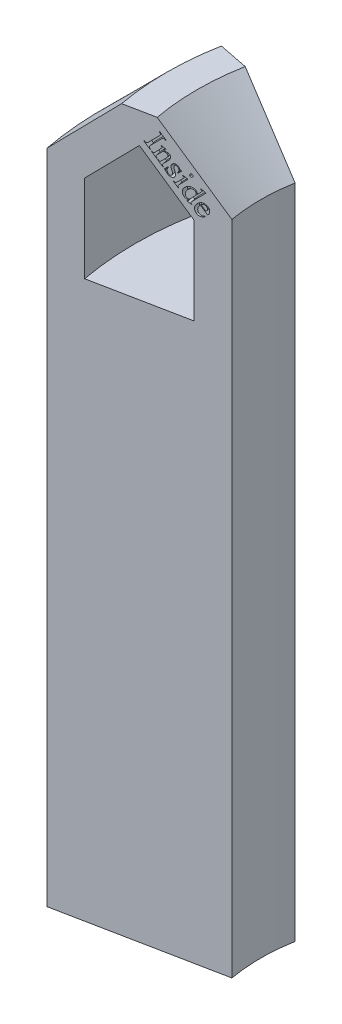
from build123d import *

# Parameters (mm, degrees)
BOSS_EXTRUDE1_DEPTH     = 66.04
REVOLVE1_ANGLE          = 22.5
CUT_EXTRUDE_THIN1_DEPTH = 0.381
CIRPATTERN1_COUNT       = 2
CIRPATTERN1_ANGLE       = 22.5
CUT_EXTRUDE1_DEPTH      = 0.762


with BuildPart() as part:
    # Sketch1 → Boss-Extrude1 (new body)
    with BuildSketch(Plane(origin=(0, 0, 0), x_dir=(1, 0, 0), z_dir=(0, 1, 0))):
        with BuildLine():
            Line((-39.049475547, 7.767423626), (-20.739195147, 4.125282404))
            ThreePointArc((-20.739195147, 4.125282404), (-21.1455, 0), (-20.739195147, -4.125282404))
            Line((-20.739195147, -4.125282404), (-39.049475547, -7.767423626))
            ThreePointArc((-39.049475547, -7.767423626), (-39.8145, 0), (-39.049475547, 7.767423626))
        make_face()
    extrude(amount=BOSS_EXTRUDE1_DEPTH)

    # Sketch2 → Revolve1 (revolve, symmetric)
    with BuildSketch(Plane.XY) as revolve1_sk:
        Polygon((-39.8145, 66.04), (-39.8145, 77.968653673), (-32.276051224, 85.507102448), (-28.683948776, 85.507102448), (-21.1455, 77.968653673), (-21.1455, 66.04), (-24.9555, 66.04), (-24.9555, 76.3905), (-30.48, 81.915), (-36.0045, 76.3905), (-36.0045, 66.04), align=None)
    revolve(axis=Axis((0, 89.782457571, 0), (0, -1, 0)), revolution_arc=REVOLVE1_ANGLE / 2)
    revolve(revolve1_sk.sketch, axis=Axis((0, 89.782457571, 0), (0, 1, 0)), revolution_arc=REVOLVE1_ANGLE / 2)

    # Sketch3 → Cut-Extrude-Thin1 (cut, symmetric)
    with BuildSketch(Plane(origin=(0, 82.55, 0), x_dir=(0.9760625312022038, 0.09801714032955729, -0.19415090879200855), z_dir=(-0.19509032201612525, 0, -0.9807852804032311))):
        Polygon((-8.091314934, 82.152499187), (-47.903679925, 78.231323488), (-35.455503103, -48.157136799), (4.356861888, -44.235961101), align=None)
    cut_extrude_thin1 = extrude(amount=CUT_EXTRUDE_THIN1_DEPTH, both=True, mode=Mode.SUBTRACT)

    # CirPattern1: Cut-Extrude-Thin1 ×2 about axis
    cirpattern1_axis = Axis((0, 66.04, 0), (0, -1, 0))
    for i in range(1, CIRPATTERN1_COUNT):
        add(cut_extrude_thin1.rotate(cirpattern1_axis, i * CIRPATTERN1_ANGLE / (CIRPATTERN1_COUNT - 1)), mode=Mode.SUBTRACT)

    # Sketch4 → Cut-Extrude1 (cut)
    # profile 1 of 7: a face of its own
    with BuildSketch(Plane(origin=(-0.074329413, 0, -0.373679192), x_dir=(0.9807852804032311, 0, -0.19509032201612525), z_dir=(0.19509032201612525, 0, 0.9807852804032311))):
        with BuildLine():
            add(Edge.make_bspline(
                [(-24.327466525, 78.206097037), (-24.346821118, 78.18639306), (-24.384465422, 78.148069213), (-24.43388239, 78.086997215), (-24.477670096, 78.026469577), (-24.514101296, 77.964952364), (-24.542881096, 77.902462627), (-24.565652124, 77.839890714), (-24.580731533, 77.776406039), (-24.585529454, 77.733716024), (-24.587915744, 77.712483756)],
                knots=[0, 0, 0, 0, 1.161636047, 2.259359291, 3.302084689, 4.303398904, 5.262322071, 6.193368654, 7.101455399, 8, 8, 8, 8], degree=3))
            add(Edge.make_bspline(
                [(-24.587915744, 77.712483756), (-24.588959994, 77.691818317), (-24.59099958, 77.651455455), (-24.58756003, 77.59207217), (-24.578078231, 77.535728183), (-24.563229736, 77.482289643), (-24.542652563, 77.431741467), (-24.516891469, 77.384052478), (-24.485475585, 77.339169423), (-24.460280061, 77.312661235), (-24.447521213, 77.299237662)],
                knots=[0, 0, 0, 0, 1.100585267, 2.149616639, 3.157995656, 4.135924672, 5.095184397, 6.05597681, 7.015559409, 8, 8, 8, 8], degree=3))
            add(Edge.make_bspline(
                [(-24.447521213, 77.299237662), (-24.429630724, 77.282784842), (-24.394695438, 77.250656934), (-24.335239961, 77.212967086), (-24.271894216, 77.18615224), (-24.215901441, 77.173437053), (-24.169301166, 77.168439494), (-24.132258776, 77.169435396), (-24.093423688, 77.172717289), (-24.0528858, 77.179988076), (-24.010317998, 77.189698254), (-23.96633458, 77.204090739), (-23.920114274, 77.220615644), (-23.889336027, 77.234215366), (-23.873540744, 77.241194693)],
                knots=[0, 0, 0, 0, 1.406948714, 2.747390434, 4.057875916, 5.37647204, 6.060453853, 6.769961423, 7.52075776, 8.318272485, 9.155426929, 10.049905726, 10.9992188, 12, 12, 12, 12], degree=3))
            Line((-23.873540744, 77.241194693), (-23.8611384, 77.18116735))
            add(Edge.make_bspline(
                [(-23.8611384, 77.18116735), (-23.876837655, 77.170142838), (-23.908123633, 77.148172838), (-23.958175336, 77.12015706), (-24.009608482, 77.094964105), (-24.063603502, 77.074855084), (-24.119418738, 77.057893074), (-24.177195747, 77.044333164), (-24.237307247, 77.035716312), (-24.298388809, 77.030080691), (-24.359703512, 77.029104795), (-24.419319005, 77.035398095), (-24.476998355, 77.04650585), (-24.532183531, 77.064596116), (-24.585129951, 77.08848202), (-24.635522824, 77.118674959), (-24.684037429, 77.15442451), (-24.71370187, 77.182334888), (-24.728806369, 77.196546256)],
                knots=[0, 0, 0, 0, 0.974023999, 1.941066178, 2.910550433, 3.881089801, 4.864453451, 5.87325648, 6.892708454, 7.946947241, 8.988760006, 10.00196145, 10.98726121, 11.967641532, 12.945246048, 13.932227849, 14.94713464, 16, 16, 16, 16], degree=3))
            add(Edge.make_bspline(
                [(-24.728806369, 77.196546256), (-24.74419155, 77.212957489), (-24.774628657, 77.245424473), (-24.813943765, 77.29869392), (-24.846444684, 77.355175468), (-24.872222636, 77.414675345), (-24.892427057, 77.476870912), (-24.905111538, 77.542344985), (-24.911516859, 77.610632967), (-24.911433592, 77.681217198), (-24.904858352, 77.752959017), (-24.889581843, 77.823997595), (-24.867673218, 77.8942238), (-24.83785971, 77.963293132), (-24.799585713, 78.030794123), (-24.75480564, 78.097716993), (-24.702037111, 78.163318765), (-24.662322625, 78.204736242), (-24.641989963, 78.225940787)],
                knots=[0, 0, 0, 0, 0.934100157, 1.847966912, 2.743675563, 3.635978115, 4.537753917, 5.455409832, 6.400963139, 7.383513908, 8.38443971, 9.388379646, 10.396706848, 11.436952101, 12.507415306, 13.616520744, 14.779727873, 16, 16, 16, 16], degree=3))
            add(Edge.make_bspline(
                [(-24.641989963, 78.225940787), (-24.619163307, 78.247965617), (-24.57458209, 78.290980843), (-24.504037521, 78.347763453), (-24.433415236, 78.397132589), (-24.361650845, 78.437313553), (-24.289461901, 78.470112587), (-24.216400678, 78.493949297), (-24.142709447, 78.509569363), (-24.069020092, 78.516801257), (-23.996205162, 78.517013094), (-23.925415428, 78.509406342), (-23.857084872, 78.495300824), (-23.791545906, 78.472956557), (-23.728395077, 78.444302095), (-23.668111274, 78.408242643), (-23.610335667, 78.365250893), (-23.575059695, 78.331823612), (-23.557032931, 78.314741568)],
                knots=[0, 0, 0, 0, 1.243069482, 2.427756017, 3.546360549, 4.617532534, 5.647758371, 6.650337774, 7.624356991, 8.595264042, 9.548321492, 10.474084257, 11.38198954, 12.277940667, 13.183133459, 14.096002218, 15.027017065, 16, 16, 16, 16], degree=3))
            add(Edge.make_bspline(
                [(-23.557032931, 78.314741568), (-23.542495807, 78.299640474), (-23.513956908, 78.269994404), (-23.477293187, 78.221589269), (-23.446368323, 78.171699591), (-23.420631002, 78.120380743), (-23.401351688, 78.066865396), (-23.387304198, 78.011731922), (-23.37938624, 77.95483404), (-23.377477418, 77.89681819), (-23.381334664, 77.838616844), (-23.391478225, 77.780966688), (-23.40717602, 77.724296517), (-23.42986491, 77.668829032), (-23.458719844, 77.614700068), (-23.494044166, 77.561917747), (-23.534413782, 77.509455016), (-23.565793223, 77.477041336), (-23.581837619, 77.460468131)],
                knots=[0, 0, 0, 0, 1.045712349, 2.05291485, 3.024259095, 3.973100843, 4.913283778, 5.858347057, 6.808695986, 7.775151561, 8.751534513, 9.715165222, 10.69266436, 11.681462838, 12.700772381, 13.749445942, 14.849285461, 16, 16, 16, 16], degree=3))
            Line((-23.581837619, 77.460468131), (-24.327466525, 78.206097037))
        make_face()
        with BuildLine():
            Line((-24.259005588, 78.274557975), (-23.759439181, 77.774991568))
            add(Edge.make_bspline(
                [(-23.759439181, 77.774991568), (-23.744505688, 77.792015567), (-23.716807421, 77.82359125), (-23.681906116, 77.869321291), (-23.65519755, 77.908678981), (-23.64357261, 77.934251982), (-23.638392306, 77.945647818)],
                knots=[0, 0, 0, 0, 1.292863799, 2.397971158, 3.286104148, 4, 4, 4, 4], degree=3))
            add(Edge.make_bspline(
                [(-23.638392306, 77.945647818), (-23.632908096, 77.961386521), (-23.622071923, 77.992484396), (-23.615090414, 78.040972922), (-23.614226038, 78.089436479), (-23.621562564, 78.137111847), (-23.63416033, 78.183035405), (-23.652555814, 78.225530539), (-23.676485879, 78.264051074), (-23.696725578, 78.285932854), (-23.706853244, 78.296882193)],
                knots=[0, 0, 0, 0, 1.056040173, 2.086614572, 3.094638458, 4.123660585, 5.13757302, 6.110933488, 7.054737261, 8, 8, 8, 8], degree=3))
            add(Edge.make_bspline(
                [(-23.706853244, 78.296882193), (-23.723627998, 78.311923799), (-23.757096721, 78.341934571), (-23.818279756, 78.372475575), (-23.885689228, 78.391779508), (-23.958725073, 78.39769746), (-24.03521855, 78.391102415), (-24.112159589, 78.368035112), (-24.188219037, 78.328997402), (-24.234738934, 78.293220598), (-24.259005588, 78.274557975)],
                knots=[0, 0, 0, 0, 0.88625929, 1.768250448, 2.671475002, 3.641616052, 4.644859199, 5.686244715, 6.793052009, 8, 8, 8, 8], degree=3))
        make_face(mode=Mode.SUBTRACT)
    # profile 2 of 7: a face of its own
    with BuildSketch(Plane(origin=(-0.074329413, 0, -0.373679192), x_dir=(0.9807852804032311, 0, -0.19509032201612525), z_dir=(0.19509032201612525, 0, 0.9807852804032311))):
        with BuildLine():
            add(Edge.make_bspline(
                [(-25.510106127, 78.286275021), (-25.536076218, 78.286241322), (-25.58578181, 78.286176824), (-25.657553489, 78.291876472), (-25.722806053, 78.303722804), (-25.782673156, 78.320543558), (-25.837512698, 78.343823934), (-25.888880312, 78.372817278), (-25.937497176, 78.407580592), (-25.966647151, 78.435080541), (-25.98139519, 78.448993771)],
                knots=[0, 0, 0, 0, 1.212323014, 2.320331972, 3.356236459, 4.304401923, 5.217885919, 6.130586425, 7.054195313, 8, 8, 8, 8], degree=3))
            add(Edge.make_bspline(
                [(-25.98139519, 78.448993771), (-25.995482983, 78.463897691), (-26.023422141, 78.493455406), (-26.058633821, 78.542878289), (-26.087570773, 78.595616819), (-26.111185789, 78.651182965), (-26.127790346, 78.710429421), (-26.139483416, 78.772492471), (-26.14408538, 78.838018216), (-26.143170125, 78.905918125), (-26.13583858, 78.974707466), (-26.12185031, 79.042855572), (-26.101099718, 79.10942968), (-26.072732578, 79.174267572), (-26.038730007, 79.23799814), (-25.99685461, 79.299727093), (-25.949037218, 79.360376819), (-25.91260979, 79.398154784), (-25.89408269, 79.417368771)],
                knots=[0, 0, 0, 0, 0.909458615, 1.803654218, 2.684097984, 3.575608536, 4.476945095, 5.409826327, 6.374142149, 7.387145793, 8.42060399, 9.439758032, 10.470475822, 11.509419077, 12.576728051, 13.671938721, 14.815941005, 16, 16, 16, 16], degree=3))
            add(Edge.make_bspline(
                [(-25.89408269, 79.417368771), (-25.874562828, 79.436092817), (-25.835814189, 79.473261689), (-25.772201702, 79.522283565), (-25.705798923, 79.566074427), (-25.635983927, 79.604059216), (-25.562662846, 79.635743874), (-25.486109964, 79.662221), (-25.406091335, 79.682435716), (-25.324026423, 79.696671384), (-25.241896376, 79.704648539), (-25.161854905, 79.703142792), (-25.085137356, 79.693219326), (-25.011704044, 79.67500355), (-24.941814083, 79.647356658), (-24.875280788, 79.611362568), (-24.812263645, 79.566517535), (-24.774330565, 79.530781347), (-24.75505144, 79.512618771)],
                knots=[0, 0, 0, 0, 1.024040451, 2.032810122, 3.037095918, 4.035031117, 5.039414601, 6.059692443, 7.100477467, 8.16231622, 9.212709849, 10.221479521, 11.188111894, 12.137725375, 13.080016395, 14.02745772, 14.997474224, 16, 16, 16, 16], degree=3))
            add(Edge.make_bspline(
                [(-24.75505144, 79.512618771), (-24.743758568, 79.500734377), (-24.721500208, 79.47731012), (-24.692350225, 79.439556274), (-24.667202125, 79.400675512), (-24.64673747, 79.36027465), (-24.63085289, 79.31851681), (-24.619310954, 79.275480203), (-24.612337726, 79.231221653), (-24.610910181, 79.201260712), (-24.610192065, 79.186189084)],
                knots=[0, 0, 0, 0, 1.072737973, 2.114377069, 3.11743726, 4.100312615, 5.073480616, 6.037269195, 7.012662821, 8, 8, 8, 8], degree=3))
            Line((-24.610192065, 79.186189084), (-24.410762377, 79.385618771))
            add(Edge.make_bspline(
                [(-24.410762377, 79.385618771), (-24.39622235, 79.400348003), (-24.368620893, 79.428308629), (-24.329249224, 79.467824316), (-24.2949953, 79.503687849), (-24.265386553, 79.535264553), (-24.240299429, 79.56247768), (-24.220591094, 79.585902048), (-24.20496044, 79.604724761), (-24.190680921, 79.623822481), (-24.178898659, 79.644649434), (-24.168559587, 79.667110893), (-24.162475696, 79.687716697), (-24.161959299, 79.712381373), (-24.170332374, 79.742164429), (-24.186188654, 79.76018746), (-24.194465502, 79.769595334)],
                knots=[0, 0, 0, 0, 1.79252827, 3.402771678, 4.831018308, 6.087433976, 7.15198616, 8.035892605, 8.738250315, 9.271056011, 10.098881991, 10.804154062, 11.412118543, 11.942222563, 12.925857062, 14, 14, 14, 14], degree=3))
            add(Edge.make_bspline(
                [(-24.194465502, 79.769595334), (-24.20033366, 79.774822708), (-24.213022295, 79.786125784), (-24.235551533, 79.802170721), (-24.26358924, 79.817051149), (-24.283895285, 79.826883058), (-24.29467644, 79.832103146)],
                knots=[0, 0, 0, 0, 0.794501395, 1.717939085, 2.788377944, 4, 4, 4, 4], degree=3))
            Line((-24.29467644, 79.832103146), (-24.268879565, 79.888657834))
            Line((-24.268879565, 79.888657834), (-23.814953784, 79.698653927))
            Line((-23.814953784, 79.698653927), (-23.761871752, 79.645571896))
            Line((-23.761871752, 79.645571896), (-25.009547534, 78.397896115))
            add(Edge.make_bspline(
                [(-25.009547534, 78.397896115), (-25.024640625, 78.382892498), (-25.053169251, 78.354532995), (-25.093040802, 78.313538542), (-25.128120239, 78.277014279), (-25.158488763, 78.244857299), (-25.183678331, 78.216830399), (-25.204894007, 78.193941383), (-25.220156054, 78.174363146), (-25.234496392, 78.155341059), (-25.246546703, 78.13468223), (-25.256948973, 78.112008835), (-25.261996987, 78.090737495), (-25.263644837, 78.06578783), (-25.255746654, 78.036270597), (-25.240802672, 78.018429048), (-25.233285815, 78.009454709)],
                knots=[0, 0, 0, 0, 1.822378418, 3.444619086, 4.896824697, 6.159106884, 7.231674298, 8.124242593, 8.829719922, 9.356525323, 10.162810505, 10.873103435, 11.484474848, 12.02332307, 13.00572703, 14, 14, 14, 14], degree=3))
            add(Edge.make_bspline(
                [(-25.233285815, 78.009454709), (-25.22728264, 78.004018304), (-25.214131183, 77.9921085), (-25.190096479, 77.976164343), (-25.1612618, 77.959745187), (-25.139936186, 77.94976628), (-25.128610034, 77.944466427)],
                knots=[0, 0, 0, 0, 0.784314892, 1.718237828, 2.788143424, 4, 4, 4, 4], degree=3))
            Line((-25.128610034, 77.944466427), (-25.156887377, 77.890392209))
            Line((-25.156887377, 77.890392209), (-25.610317065, 78.077915646))
            Line((-25.610317065, 78.077915646), (-25.664391284, 78.131989865))
            Line((-25.664391284, 78.131989865), (-25.510106127, 78.286275021))
        make_face()
        with BuildLine():
            Line((-25.427754565, 78.368626584), (-24.871633471, 78.924747677))
            add(Edge.make_bspline(
                [(-24.871633471, 78.924747677), (-24.860071563, 78.939404855), (-24.837329324, 78.968235481), (-24.809008059, 79.014963067), (-24.785514729, 79.063044779), (-24.76767553, 79.112600004), (-24.755574841, 79.162305648), (-24.750444385, 79.211538892), (-24.752299737, 79.259707863), (-24.76155935, 79.305914723), (-24.775232383, 79.349596993), (-24.7934536, 79.389075106), (-24.81546482, 79.424328601), (-24.833459741, 79.444231439), (-24.84236394, 79.454079709)],
                knots=[0, 0, 0, 0, 1.154423248, 2.270747131, 3.373857381, 4.461573529, 5.524008054, 6.532166117, 7.51550029, 8.494992464, 9.440090433, 10.3421512, 11.179667723, 12, 12, 12, 12], degree=3))
            add(Edge.make_bspline(
                [(-24.84236394, 79.454079709), (-24.851076435, 79.46244155), (-24.868373493, 79.47904245), (-24.898183464, 79.499358671), (-24.930001196, 79.516218776), (-24.963866857, 79.529804934), (-25.000066389, 79.539157204), (-25.03828838, 79.545003035), (-25.078814516, 79.547584054), (-25.10645155, 79.54644379), (-25.120672534, 79.545857052)],
                knots=[0, 0, 0, 0, 0.956343444, 1.898644233, 2.849124082, 3.808699638, 4.785332493, 5.807406151, 6.871773192, 8, 8, 8, 8], degree=3))
            add(Edge.make_bspline(
                [(-25.120672534, 79.545857052), (-25.139920339, 79.543798153), (-25.178805241, 79.539638713), (-25.236977413, 79.525400534), (-25.294938873, 79.503710249), (-25.353333063, 79.475845913), (-25.411562247, 79.440647995), (-25.470109508, 79.398878093), (-25.528864224, 79.350004144), (-25.566562616, 79.313607825), (-25.586008471, 79.294833615)],
                knots=[0, 0, 0, 0, 0.859528183, 1.736440549, 2.652447478, 3.605635851, 4.60754701, 5.671944745, 6.799125865, 8, 8, 8, 8], degree=3))
            add(Edge.make_bspline(
                [(-25.586008471, 79.294833615), (-25.604920754, 79.2751986), (-25.641667685, 79.237047384), (-25.691526274, 79.177958291), (-25.734305572, 79.118920785), (-25.770393658, 79.060071793), (-25.799729915, 79.001463467), (-25.822979657, 78.943173643), (-25.83906235, 78.884940958), (-25.847681232, 78.827288445), (-25.851252648, 78.771662541), (-25.849708484, 78.718711341), (-25.844110238, 78.66893914), (-25.833013633, 78.622402975), (-25.817624981, 78.578942061), (-25.797798153, 78.538461111), (-25.772956448, 78.501182073), (-25.7525281, 78.479644288), (-25.742278002, 78.468837521)],
                knots=[0, 0, 0, 0, 1.403451492, 2.726933471, 3.977062213, 5.154039808, 6.277344553, 7.347773462, 8.380561495, 9.380066995, 10.344052965, 11.24695433, 12.104515681, 12.918221288, 13.70460606, 14.473793649, 15.234212986, 16, 16, 16, 16], degree=3))
            add(Edge.make_bspline(
                [(-25.742278002, 78.468837521), (-25.733047821, 78.460328831), (-25.714363007, 78.443104543), (-25.682580079, 78.421601653), (-25.647806156, 78.403130149), (-25.609472998, 78.389876113), (-25.568445646, 78.378618582), (-25.524247219, 78.371295612), (-25.476922002, 78.367896316), (-25.444460318, 78.368378459), (-25.427754565, 78.368626584)],
                knots=[0, 0, 0, 0, 0.885953479, 1.793450963, 2.702827093, 3.660182263, 4.652206202, 5.706804258, 6.819852917, 8, 8, 8, 8], degree=3))
        make_face(mode=Mode.SUBTRACT)
    # profile 3 of 7: a face of its own
    with BuildSketch(Plane(origin=(-0.074329413, 0, -0.373679192), x_dir=(0.9807852804032311, 0, -0.19509032201612525), z_dir=(0.19509032201612525, 0, 0.9807852804032311))):
        with BuildLine():
            add(Edge.make_bspline(
                [(-25.118055212, 81.001676852), (-25.110354367, 80.993388631), (-25.09521867, 80.977098467), (-25.080059561, 80.947572771), (-25.070046485, 80.916044998), (-25.067593511, 80.882768216), (-25.070191162, 80.8494002), (-25.079802738, 80.817865665), (-25.095521364, 80.788499801), (-25.11039569, 80.772031955), (-25.118055212, 80.763551852)],
                knots=[0, 0, 0, 0, 1.020809164, 2.006359082, 2.978140455, 4.001147273, 5.009226956, 5.995346391, 6.967705346, 8, 8, 8, 8], degree=3))
            add(Edge.make_bspline(
                [(-25.118055212, 80.763551852), (-25.126396388, 80.756102448), (-25.142926204, 80.741339867), (-25.172121988, 80.725267184), (-25.204096059, 80.715835525), (-25.237592444, 80.712349875), (-25.271075401, 80.71535919), (-25.302946999, 80.724151155), (-25.332211915, 80.740073398), (-25.348688035, 80.754916317), (-25.357172399, 80.762559665)],
                knots=[0, 0, 0, 0, 1.008168586, 1.997900662, 2.981069905, 4.002437856, 5.022384127, 6.00134375, 6.97079368, 8, 8, 8, 8], degree=3))
            add(Edge.make_bspline(
                [(-25.357172399, 80.762559665), (-25.364672632, 80.770875225), (-25.37948289, 80.787295464), (-25.394800065, 80.816777337), (-25.404671926, 80.84871227), (-25.407113214, 80.882614352), (-25.404671926, 80.916516434), (-25.394800065, 80.948451368), (-25.37948289, 80.977933241), (-25.364672632, 80.994353479), (-25.357172399, 81.00266904)],
                knots=[0, 0, 0, 0, 1.005963088, 1.986414951, 2.967433385, 4, 5.032566615, 6.013585049, 6.994036912, 8, 8, 8, 8], degree=3))
            add(Edge.make_bspline(
                [(-25.357172399, 81.00266904), (-25.348692359, 81.010328396), (-25.332224636, 81.025202402), (-25.30285789, 81.040923335), (-25.271326738, 81.050526073), (-25.237945695, 81.053157745), (-25.204558965, 81.050565248), (-25.172637503, 81.04088788), (-25.143060373, 81.024799478), (-25.126523637, 81.009507724), (-25.118055212, 81.001676852)],
                knots=[0, 0, 0, 0, 1.026825298, 1.99403245, 2.974927176, 3.977665799, 4.99525247, 5.976147196, 6.963589571, 8, 8, 8, 8], degree=3))
        make_face()
    # profile 4 of 7: a face of its own
    with BuildSketch(Plane(origin=(-0.074329413, 0, -0.373679192), x_dir=(0.9807852804032311, 0, -0.19509032201612525), z_dir=(0.19509032201612525, 0, 0.9807852804032311))):
        with BuildLine():
            Line((-25.583887243, 80.339391696), (-26.451059118, 79.472219821))
            add(Edge.make_bspline(
                [(-26.451059118, 79.472219821), (-26.466451003, 79.456509319), (-26.494398753, 79.427983042), (-26.529887931, 79.387113653), (-26.55590645, 79.35352752), (-26.571717455, 79.324576771), (-26.579562744, 79.299161788), (-26.58303862, 79.275403903), (-26.583312813, 79.251921083), (-26.578662762, 79.227816201), (-26.567105396, 79.202170039), (-26.54838528, 79.173606852), (-26.521471086, 79.141311724), (-26.500324534, 79.119190197), (-26.488762243, 79.107094821)],
                knots=[0, 0, 0, 0, 1.796342424, 3.261701174, 4.420867892, 5.260867186, 5.940262287, 6.582225239, 7.217184489, 7.850416738, 8.570628208, 9.50005727, 10.63310754, 12, 12, 12, 12], degree=3))
            Line((-26.488762243, 79.107094821), (-26.531426306, 79.064430759))
            Line((-26.531426306, 79.064430759), (-27.055797399, 79.588801852))
            Line((-27.055797399, 79.588801852), (-27.013133337, 79.631465915))
            add(Edge.make_bspline(
                [(-27.013133337, 79.631465915), (-27.000924803, 79.619505554), (-26.978635594, 79.597669437), (-26.945712654, 79.570978225), (-26.918350636, 79.551052175), (-26.893367216, 79.540051998), (-26.87008633, 79.536011392), (-26.846987996, 79.536238694), (-26.822822747, 79.539613241), (-26.796533745, 79.548163943), (-26.766404489, 79.564122203), (-26.731843411, 79.590007299), (-26.690794975, 79.625187429), (-26.662542992, 79.652929984), (-26.647016149, 79.668176852)],
                knots=[0, 0, 0, 0, 1.390742953, 2.539089619, 3.45042623, 4.138259404, 4.740487588, 5.35993424, 6.013150583, 6.720095677, 7.599431319, 8.776629534, 10.228486655, 12, 12, 12, 12], degree=3))
            Line((-26.647016149, 79.668176852), (-26.231289587, 80.083903415))
            add(Edge.make_bspline(
                [(-26.231289587, 80.083903415), (-26.217374979, 80.09793598), (-26.190779939, 80.124756472), (-26.153276845, 80.163320617), (-26.119627215, 80.198152366), (-26.090708829, 80.229900782), (-26.065182237, 80.257500565), (-26.044294748, 80.281790861), (-26.027733855, 80.302647936), (-26.018579869, 80.315707112), (-26.014496618, 80.321532321)],
                knots=[0, 0, 0, 0, 1.472950457, 2.815255353, 4.009569287, 5.08246491, 6.016044298, 6.811500611, 7.46985497, 8, 8, 8, 8], degree=3))
            add(Edge.make_bspline(
                [(-26.014496618, 80.321532321), (-26.01024719, 80.328907361), (-26.002301484, 80.342697429), (-25.992832363, 80.36306071), (-25.988196586, 80.382145437), (-25.987388705, 80.405531518), (-25.996238823, 80.435307661), (-26.012614303, 80.453570224), (-26.021441931, 80.463415134)],
                knots=[0, 0, 0, 0, 0.976680293, 1.826225856, 2.567134071, 3.212485338, 4.497317836, 6, 6, 6, 6], degree=3))
            add(Edge.make_bspline(
                [(-26.021441931, 80.463415134), (-26.027418351, 80.469048167), (-26.039981884, 80.480889838), (-26.063059974, 80.496078697), (-26.089543344, 80.511366158), (-26.109011429, 80.520604886), (-26.119172399, 80.525426852)],
                knots=[0, 0, 0, 0, 0.84580649, 1.778040569, 2.840293589, 4, 4, 4, 4], degree=3))
            Line((-26.119172399, 80.525426852), (-26.092879431, 80.584462009))
            Line((-26.092879431, 80.584462009), (-25.635977087, 80.39148154))
            Line((-25.635977087, 80.39148154), (-25.583887243, 80.339391696))
        make_face()
    # profile 5 of 7: a face of its own
    with BuildSketch(Plane(origin=(-0.074329413, 0, -0.373679192), x_dir=(0.9807852804032311, 0, -0.19509032201612525), z_dir=(0.19509032201612525, 0, 0.9807852804032311))):
        with BuildLine():
            Line((-26.20192768, 80.957322229), (-26.569533149, 80.58971676))
            Line((-26.569533149, 80.58971676), (-26.608228462, 80.628412072))
            add(Edge.make_bspline(
                [(-26.608228462, 80.628412072), (-26.598172337, 80.646031271), (-26.578730981, 80.680094208), (-26.552770621, 80.730610505), (-26.531549166, 80.778765464), (-26.513933969, 80.823830656), (-26.500654776, 80.866375838), (-26.492323107, 80.906446246), (-26.487598468, 80.943793776), (-26.486830284, 80.989688414), (-26.495387376, 81.044728111), (-26.51914047, 81.107392506), (-26.554527026, 81.167575083), (-26.586989359, 81.202305612), (-26.603763618, 81.220251916)],
                knots=[0, 0, 0, 0, 1.125042986, 2.175028995, 3.148103104, 4.042260968, 4.857446244, 5.61647911, 6.309236519, 6.942099934, 8.157417897, 9.37034592, 10.64117905, 12, 12, 12, 12], degree=3))
            add(Edge.make_bspline(
                [(-26.603763618, 81.220251916), (-26.617216462, 81.233048016), (-26.643076757, 81.257645855), (-26.687624804, 81.284333527), (-26.732944068, 81.303378343), (-26.779431271, 81.310773092), (-26.823529761, 81.310342711), (-26.863839149, 81.303347206), (-26.899390134, 81.287866411), (-26.918306754, 81.271533456), (-26.927712837, 81.263412072)],
                knots=[0, 0, 0, 0, 1.22958479, 2.363620922, 3.428302631, 4.475619269, 5.464212439, 6.347426835, 7.178276054, 8, 8, 8, 8], degree=3))
            add(Edge.make_bspline(
                [(-26.927712837, 81.263412072), (-26.937855157, 81.252303953), (-26.957577858, 81.230703162), (-26.980300718, 81.193645195), (-26.996148387, 81.154175651), (-27.000796813, 81.126450553), (-27.003119087, 81.112599572)],
                knots=[0, 0, 0, 0, 1.049152949, 2.040177271, 3.020906365, 4, 4, 4, 4], degree=3))
            add(Edge.make_bspline(
                [(-27.003119087, 81.112599572), (-27.004103036, 81.096878062), (-27.006296555, 81.061830089), (-26.997843448, 81.003805991), (-26.981694411, 80.935743442), (-26.96597389, 80.887595477), (-26.957478462, 80.861576135)],
                knots=[0, 0, 0, 0, 0.733955819, 1.636208154, 2.722597973, 4, 4, 4, 4], degree=3))
            Line((-26.957478462, 80.861576135), (-26.86867768, 80.606087854))
            add(Edge.make_bspline(
                [(-26.86867768, 80.606087854), (-26.859487237, 80.577477008), (-26.841840718, 80.522541483), (-26.825848826, 80.440837716), (-26.819550891, 80.364252612), (-26.82261848, 80.29259947), (-26.835857019, 80.225833431), (-26.859610105, 80.164352973), (-26.892887693, 80.107820169), (-26.922308444, 80.075622487), (-26.937138618, 80.059392541)],
                knots=[0, 0, 0, 0, 1.236499671, 2.374196078, 3.41913714, 4.393957125, 5.3179953, 6.208175287, 7.09679154, 8, 8, 8, 8], degree=3))
            add(Edge.make_bspline(
                [(-26.937138618, 80.059392541), (-26.949461168, 80.047696262), (-26.973548688, 80.024832946), (-27.013299223, 79.995891834), (-27.054445747, 79.971918695), (-27.097541506, 79.953243259), (-27.142455916, 79.940527409), (-27.188835346, 79.932349517), (-27.236954604, 79.930106505), (-27.285941127, 79.932645129), (-27.334890046, 79.93960509), (-27.3823262, 79.950485086), (-27.428012819, 79.964953401), (-27.471520866, 79.983221006), (-27.513032436, 80.00539343), (-27.552695384, 80.030510874), (-27.590401187, 80.059584418), (-27.613499656, 80.081506679), (-27.625220649, 80.092630822)],
                knots=[0, 0, 0, 0, 1.062902335, 2.077709572, 3.070513532, 4.039930978, 5.009956539, 5.987085382, 6.982477863, 8.019235067, 9.054543418, 10.074356874, 11.063319558, 12.051794254, 13.02452407, 14.006905743, 14.988632349, 16, 16, 16, 16], degree=3))
            add(Edge.make_bspline(
                [(-27.625220649, 80.092630822), (-27.641870711, 80.110245609), (-27.676322823, 80.146693916), (-27.724419419, 80.208378784), (-27.771508067, 80.278005595), (-27.800952278, 80.32810151), (-27.816216743, 80.354072229)],
                knots=[0, 0, 0, 0, 0.8954294, 1.852811898, 2.886855022, 4, 4, 4, 4], degree=3))
            add(Edge.make_bspline(
                [(-27.816216743, 80.354072229), (-27.824416277, 80.369183423), (-27.839031923, 80.396119085), (-27.859031078, 80.419301601), (-27.867810493, 80.429478479)],
                knots=[0, 0, 0, 0, 1.122021362, 2, 2, 2, 2], degree=3))
            add(Edge.make_bspline(
                [(-27.867810493, 80.429478479), (-27.872570381, 80.433428991), (-27.88194345, 80.441208253), (-27.900050208, 80.447615036), (-27.920422025, 80.447052637), (-27.934022787, 80.443348331), (-27.941232368, 80.441384729)],
                knots=[0, 0, 0, 0, 0.939568538, 1.85017787, 2.860408221, 4, 4, 4, 4], degree=3))
            Line((-27.941232368, 80.441384729), (-27.97992768, 80.480080041))
            Line((-27.97992768, 80.480080041), (-27.59495893, 80.865048791))
            Line((-27.59495893, 80.865048791), (-27.556263618, 80.826353479))
            add(Edge.make_bspline(
                [(-27.556263618, 80.826353479), (-27.566743152, 80.810118804), (-27.587217934, 80.778399699), (-27.613365422, 80.729718611), (-27.635477152, 80.681926633), (-27.653024686, 80.634673959), (-27.665730964, 80.587966322), (-27.675216329, 80.542124073), (-27.678870838, 80.496690787), (-27.679017952, 80.452214193), (-27.675053931, 80.409036494), (-27.66734145, 80.367660742), (-27.657518924, 80.327833284), (-27.642366904, 80.29059439), (-27.626023209, 80.254368502), (-27.604745888, 80.220854548), (-27.581089049, 80.188627851), (-27.5626076, 80.169333823), (-27.553287055, 80.159603479)],
                knots=[0, 0, 0, 0, 1.277092358, 2.495167032, 3.649714828, 4.756587, 5.822867475, 6.847765273, 7.846496678, 8.830458041, 9.785633526, 10.707764195, 11.612028382, 12.491158961, 13.36168179, 14.23549376, 15.110126083, 16, 16, 16, 16], degree=3))
            add(Edge.make_bspline(
                [(-27.553287055, 80.159603479), (-27.539803383, 80.147177506), (-27.51369512, 80.123117254), (-27.468874208, 80.096512017), (-27.421871645, 80.079460545), (-27.373567148, 80.073503466), (-27.326220009, 80.075221678), (-27.282164937, 80.087985447), (-27.241022532, 80.107385981), (-27.21879771, 80.12786841), (-27.207509712, 80.138271447)],
                knots=[0, 0, 0, 0, 1.136306935, 2.200216734, 3.213754261, 4.218930848, 5.206265623, 6.133203209, 7.051852917, 8, 8, 8, 8], degree=3))
            add(Edge.make_bspline(
                [(-27.207509712, 80.138271447), (-27.194919165, 80.151991916), (-27.170376794, 80.178736811), (-27.145566453, 80.226831505), (-27.129953402, 80.278104785), (-27.126800793, 80.324120889), (-27.128818831, 80.364274715), (-27.133578374, 80.399185155), (-27.140475415, 80.438621122), (-27.150674406, 80.482216904), (-27.163155586, 80.530493765), (-27.177988232, 80.583271648), (-27.195282413, 80.640579677), (-27.215670653, 80.700384584), (-27.234983121, 80.760656096), (-27.252178352, 80.81825967), (-27.265449793, 80.871790723), (-27.276012919, 80.921069742), (-27.283732511, 80.966059126), (-27.287650249, 81.007005169), (-27.289092787, 81.043679765), (-27.287250717, 81.066634141), (-27.286388618, 81.077376916)],
                knots=[0, 0, 0, 0, 1.134079978, 2.210627688, 3.275958318, 4.391908569, 5.009438168, 5.733079142, 6.544311223, 7.456788893, 8.469627882, 9.593247357, 10.808697884, 12.12924739, 13.456284226, 14.678529015, 15.804148461, 16.827431436, 17.759968392, 18.593024551, 19.341527717, 20, 20, 20, 20], degree=3))
            add(Edge.make_bspline(
                [(-27.286388618, 81.077376916), (-27.282857108, 81.097273542), (-27.27573941, 81.137374853), (-27.250512215, 81.19470169), (-27.215699093, 81.250071539), (-27.185121394, 81.282736663), (-27.169310493, 81.299626916)],
                knots=[0, 0, 0, 0, 0.945180913, 1.904996084, 2.916730108, 4, 4, 4, 4], degree=3))
            add(Edge.make_bspline(
                [(-27.169310493, 81.299626916), (-27.158090513, 81.310262242), (-27.136158802, 81.331051127), (-27.100431698, 81.35816311), (-27.063155496, 81.380990016), (-27.024506044, 81.39991154), (-26.984315909, 81.414638536), (-26.94262549, 81.42424179), (-26.899473943, 81.430523481), (-26.855264453, 81.43161347), (-26.81067555, 81.429591791), (-26.767025059, 81.421832871), (-26.72431486, 81.410348182), (-26.682542318, 81.394657124), (-26.642428496, 81.373473968), (-26.603173281, 81.348371408), (-26.565165423, 81.318768514), (-26.541403407, 81.296195039), (-26.529349555, 81.284744104)],
                knots=[0, 0, 0, 0, 1.034518992, 2.022175717, 2.996334791, 3.956997984, 4.899170909, 5.855229033, 6.816657593, 7.813703136, 8.811731838, 9.800133028, 10.775109745, 11.770370837, 12.780608295, 13.806440196, 14.887264271, 16, 16, 16, 16], degree=3))
            add(Edge.make_bspline(
                [(-26.529349555, 81.284744104), (-26.518563587, 81.273176864), (-26.495861531, 81.248830406), (-26.464128492, 81.206558371), (-26.432601521, 81.157486717), (-26.412731617, 81.121813246), (-26.402349555, 81.103173791)],
                knots=[0, 0, 0, 0, 0.853323411, 1.796055367, 2.848434861, 4, 4, 4, 4], degree=3))
            add(Edge.make_bspline(
                [(-26.402349555, 81.103173791), (-26.395802395, 81.091390604), (-26.383923001, 81.070010782), (-26.367094951, 81.041892676), (-26.353735631, 81.020437205), (-26.344251683, 81.009823428), (-26.340337837, 81.005443322)],
                knots=[0, 0, 0, 0, 1.394172145, 2.529634179, 3.393207811, 4, 4, 4, 4], degree=3))
            add(Edge.make_bspline(
                [(-26.340337837, 81.005443322), (-26.334395819, 80.999995311), (-26.323524649, 80.990027946), (-26.300959885, 80.982019839), (-26.27287808, 80.986290436), (-26.252715501, 80.992370826), (-26.240622993, 80.996017541)],
                knots=[0, 0, 0, 0, 0.89496106, 1.637368848, 2.583011815, 4, 4, 4, 4], degree=3))
            Line((-26.240622993, 80.996017541), (-26.20192768, 80.957322229))
        make_face()
    # profile 6 of 7: a face of its own
    with BuildSketch(Plane(origin=(-0.074329413, 0, -0.373679192), x_dir=(0.9807852804032311, 0, -0.19509032201612525), z_dir=(0.19509032201612525, 0, 0.9807852804032311))):
        with BuildLine():
            add(Edge.make_bspline(
                [(-28.026016501, 82.323871306), (-27.992470462, 82.326455304), (-27.927920663, 82.331427471), (-27.834544266, 82.331641459), (-27.748759919, 82.324801962), (-27.670740575, 82.311856959), (-27.600320467, 82.291900733), (-27.53737133, 82.265871886), (-27.481716134, 82.232802344), (-27.450796151, 82.204680216), (-27.435664939, 82.190918181)],
                knots=[0, 0, 0, 0, 1.293770419, 2.489492691, 3.587069233, 4.600283195, 5.526345912, 6.395744681, 7.214930778, 8, 8, 8, 8], degree=3))
            add(Edge.make_bspline(
                [(-27.435664939, 82.190918181), (-27.421946174, 82.176264018), (-27.395131588, 82.147621108), (-27.363992247, 82.098923489), (-27.340371412, 82.04818808), (-27.326344089, 81.994441166), (-27.321886777, 81.937375055), (-27.327610619, 81.87682595), (-27.344637578, 81.812444369), (-27.362665027, 81.769854121), (-27.372164939, 81.747410369)],
                knots=[0, 0, 0, 0, 0.997534579, 1.949773078, 2.863470944, 3.774047843, 4.699099176, 5.699381836, 6.787644873, 8, 8, 8, 8], degree=3))
            add(Edge.make_bspline(
                [(-27.372164939, 81.747410369), (-27.381384275, 81.730148249), (-27.401728193, 81.692056663), (-27.444191888, 81.634827238), (-27.498268315, 81.570779745), (-27.540512085, 81.527841705), (-27.563161033, 81.504820525)],
                knots=[0, 0, 0, 0, 0.756605725, 1.6695697, 2.750542538, 4, 4, 4, 4], degree=3))
            Line((-27.563161033, 81.504820525), (-28.023536033, 81.044445525))
            add(Edge.make_bspline(
                [(-28.023536033, 81.044445525), (-28.039164522, 81.028624173), (-28.067748405, 80.999687555), (-28.103251735, 80.95730221), (-28.130554844, 80.922152694), (-28.141737106, 80.898771563), (-28.146567283, 80.888672087)],
                knots=[0, 0, 0, 0, 1.33669824, 2.444767595, 3.328217652, 4, 4, 4, 4], degree=3))
            add(Edge.make_bspline(
                [(-28.146567283, 80.888672087), (-28.150525978, 80.874407807), (-28.158524785, 80.84558588), (-28.153276766, 80.806104129), (-28.139423348, 80.773580432), (-28.119860768, 80.745060764), (-28.093312238, 80.712085024), (-28.071548369, 80.689872784), (-28.059750876, 80.677832244)],
                knots=[0, 0, 0, 0, 1.088725464, 2.199842109, 2.864418397, 3.697186905, 4.751719142, 6, 6, 6, 6], degree=3))
            Line((-28.059750876, 80.677832244), (-28.102414939, 80.635168181))
            Line((-28.102414939, 80.635168181), (-28.636211814, 81.168965056))
            Line((-28.636211814, 81.168965056), (-28.593547751, 81.211629119))
            Line((-28.593547751, 81.211629119), (-28.571223533, 81.1893049))
            add(Edge.make_bspline(
                [(-28.571223533, 81.1893049), (-28.559369235, 81.177979094), (-28.53734582, 81.156937534), (-28.503927064, 81.13148093), (-28.473215904, 81.114016811), (-28.444096828, 81.105315787), (-28.416122059, 81.104735749), (-28.388606861, 81.108708927), (-28.36066539, 81.117971056), (-28.34289326, 81.127347978), (-28.333594626, 81.132254119)],
                knots=[0, 0, 0, 0, 1.460707291, 2.713763662, 3.736171621, 4.594749322, 5.391354471, 6.21068783, 7.063806128, 8, 8, 8, 8], degree=3))
            add(Edge.make_bspline(
                [(-28.333594626, 81.132254119), (-28.328435429, 81.136181476), (-28.314597825, 81.146715133), (-28.289902586, 81.168211068), (-28.256947585, 81.200296894), (-28.232036518, 81.224999794), (-28.218004783, 81.238914275)],
                knots=[0, 0, 0, 0, 0.494211936, 1.325537241, 2.493546932, 4, 4, 4, 4], degree=3))
            Line((-28.218004783, 81.238914275), (-27.776481345, 81.680437712))
            add(Edge.make_bspline(
                [(-27.776481345, 81.680437712), (-27.764650662, 81.69242241), (-27.741878961, 81.715490559), (-27.710389971, 81.750248754), (-27.683177166, 81.784076899), (-27.659263816, 81.816300051), (-27.638796429, 81.846943478), (-27.622075732, 81.876335248), (-27.609749341, 81.904706857), (-27.597686095, 81.939778597), (-27.591297241, 81.983612371), (-27.599599246, 82.035829697), (-27.624235327, 82.085515673), (-27.649539799, 82.11360605), (-27.662875876, 82.128410369)],
                knots=[0, 0, 0, 0, 1.152336797, 2.218018182, 3.207692687, 4.122044618, 4.963161197, 5.7281378, 6.432457539, 7.07657127, 8.264042656, 9.421203171, 10.640910795, 12, 12, 12, 12], degree=3))
            add(Edge.make_bspline(
                [(-27.662875876, 82.128410369), (-27.675151507, 82.139687869), (-27.699840717, 82.162369604), (-27.742669313, 82.190086017), (-27.789865166, 82.213037875), (-27.841755034, 82.23143888), (-27.898664194, 82.244690064), (-27.960285097, 82.252929819), (-28.026484549, 82.256327175), (-28.071987927, 82.25506798), (-28.095469626, 82.254418181)],
                knots=[0, 0, 0, 0, 0.861247079, 1.732172583, 2.627592786, 3.572073161, 4.57446229, 5.645353543, 6.784901211, 8, 8, 8, 8], degree=3))
            Line((-28.095469626, 82.254418181), (-28.664489158, 81.68539865))
            add(Edge.make_bspline(
                [(-28.664489158, 81.68539865), (-28.673133963, 81.676678645), (-28.689603803, 81.660065538), (-28.71228792, 81.635783394), (-28.732150935, 81.613969594), (-28.749223115, 81.594617253), (-28.763157979, 81.57725614), (-28.774121798, 81.562140289), (-28.781877801, 81.548966094), (-28.785436912, 81.540736919), (-28.787024314, 81.537066619)],
                knots=[0, 0, 0, 0, 1.524319025, 2.904089727, 4.124871403, 5.187070821, 6.107248813, 6.887646184, 7.503878215, 8, 8, 8, 8], degree=3))
            add(Edge.make_bspline(
                [(-28.787024314, 81.537066619), (-28.789595132, 81.528696588), (-28.794565627, 81.512513724), (-28.797635854, 81.487844973), (-28.796402378, 81.464148401), (-28.792295106, 81.439644327), (-28.779006473, 81.413374171), (-28.758484011, 81.382563484), (-28.727379516, 81.347227298), (-28.703447442, 81.322155564), (-28.690286033, 81.3083674)],
                knots=[0, 0, 0, 0, 0.790514041, 1.528403182, 2.231563027, 2.932176337, 3.754822339, 4.865861831, 6.2763853, 8, 8, 8, 8], degree=3))
            Line((-28.690286033, 81.3083674), (-28.732950095, 81.265703337))
            Line((-28.732950095, 81.265703337), (-29.26674697, 81.799500212))
            Line((-29.26674697, 81.799500212), (-29.224082908, 81.842164275))
            Line((-29.224082908, 81.842164275), (-29.200270408, 81.818351775))
            add(Edge.make_bspline(
                [(-29.200270408, 81.818351775), (-29.187106932, 81.80612996), (-29.162891721, 81.783647007), (-29.123414005, 81.759042374), (-29.084769513, 81.74662069), (-29.052715178, 81.746746336), (-29.028260185, 81.753801606), (-29.008232265, 81.761783379), (-28.986869201, 81.77341297), (-28.964198778, 81.788468298), (-28.939737485, 81.806363688), (-28.913983969, 81.827825588), (-28.886828437, 81.8526474), (-28.868496225, 81.870551717), (-28.858957908, 81.8798674)],
                knots=[0, 0, 0, 0, 1.58873607, 2.922600289, 4.085650155, 5.140353129, 5.701745734, 6.332768134, 7.047036992, 7.851435874, 8.742031413, 9.730367414, 10.819101779, 12, 12, 12, 12], degree=3))
            Line((-28.858957908, 81.8798674), (-28.458610251, 82.280215056))
            add(Edge.make_bspline(
                [(-28.458610251, 82.280215056), (-28.443188189, 82.295551104), (-28.413835535, 82.324740047), (-28.372955726, 82.366711153), (-28.336907558, 82.404249973), (-28.305855792, 82.437047676), (-28.280014735, 82.465745668), (-28.258313845, 82.489138842), (-28.242684839, 82.509014927), (-28.228166042, 82.528211522), (-28.216443231, 82.548925522), (-28.205147664, 82.570926799), (-28.200301666, 82.591674392), (-28.198416796, 82.616247638), (-28.208164226, 82.646685209), (-28.224635498, 82.665247116), (-28.233383689, 82.675105681)],
                knots=[0, 0, 0, 0, 1.822600681, 3.468937301, 4.90967971, 6.18414327, 7.253349604, 8.14639708, 8.856261644, 9.371800766, 10.160842704, 10.849003802, 11.433828279, 11.93347755, 12.902432533, 14, 14, 14, 14], degree=3))
            add(Edge.make_bspline(
                [(-28.233383689, 82.675105681), (-28.239404896, 82.68051654), (-28.252222691, 82.692035041), (-28.274514809, 82.707639255), (-28.30073478, 82.722762185), (-28.319949245, 82.731499442), (-28.33012197, 82.736125212)],
                knots=[0, 0, 0, 0, 0.844467427, 1.797681104, 2.834025121, 4, 4, 4, 4], degree=3))
            Line((-28.33012197, 82.736125212), (-28.304821189, 82.796152556))
            Line((-28.304821189, 82.796152556), (-27.847918845, 82.603172087))
            Line((-27.847918845, 82.603172087), (-27.797317283, 82.552570525))
            Line((-27.797317283, 82.552570525), (-28.026016501, 82.323871306))
        make_face()
    # profile 7 of 7: a face of its own
    with BuildSketch(Plane(origin=(-0.074329413, 0, -0.373679192), x_dir=(0.9807852804032311, 0, -0.19509032201612525), z_dir=(0.19509032201612525, 0, 0.9807852804032311))):
        with BuildLine():
            Line((-29.318474153, 81.938445691), (-29.362130403, 81.894789441))
            Line((-29.362130403, 81.894789441), (-30.046739778, 82.579398816))
            Line((-30.046739778, 82.579398816), (-30.003083528, 82.623055066))
            Line((-30.003083528, 82.623055066), (-29.94652884, 82.566500379))
            add(Edge.make_bspline(
                [(-29.94652884, 82.566500379), (-29.930572443, 82.551493846), (-29.900480122, 82.523192884), (-29.848830431, 82.494830705), (-29.796962523, 82.477506016), (-29.762266567, 82.479295462), (-29.745114778, 82.480180066)],
                knots=[0, 0, 0, 0, 1.154164432, 2.176649636, 3.098635024, 4, 4, 4, 4], degree=3))
            add(Edge.make_bspline(
                [(-29.745114778, 82.480180066), (-29.73910034, 82.481473841), (-29.726041501, 82.484282948), (-29.705854315, 82.49348928), (-29.683157614, 82.506241917), (-29.658439773, 82.524197559), (-29.630729248, 82.545227278), (-29.600857986, 82.570842609), (-29.568752178, 82.6006257), (-29.546788163, 82.622171411), (-29.535267122, 82.633473035)],
                knots=[0, 0, 0, 0, 0.56028523, 1.216518408, 2.014329208, 2.935850433, 4.001893587, 5.190869536, 6.526494038, 8, 8, 8, 8], degree=3))
            Line((-29.535267122, 82.633473035), (-28.502896028, 83.665844129))
            add(Edge.make_bspline(
                [(-28.502896028, 83.665844129), (-28.49326666, 83.675563232), (-28.474827808, 83.694173913), (-28.449158669, 83.72127301), (-28.426517982, 83.746433661), (-28.406848701, 83.769310569), (-28.39034663, 83.790494424), (-28.376494463, 83.808979159), (-28.365555997, 83.825571002), (-28.36041154, 83.836442567), (-28.358036653, 83.841461316)],
                knots=[0, 0, 0, 0, 1.436733206, 2.751137031, 3.91928725, 4.991040698, 5.918597018, 6.738282035, 7.417540592, 8, 8, 8, 8], degree=3))
            add(Edge.make_bspline(
                [(-28.358036653, 83.841461316), (-28.355651302, 83.848676965), (-28.350802554, 83.863344351), (-28.34779754, 83.887370162), (-28.349527491, 83.913338713), (-28.353486371, 83.930967269), (-28.355556184, 83.940183972)],
                knots=[0, 0, 0, 0, 0.906642868, 1.842950087, 2.872233789, 4, 4, 4, 4], degree=3))
            add(Edge.make_bspline(
                [(-28.355556184, 83.940183972), (-28.359870574, 83.953207615), (-28.368375715, 83.978881674), (-28.386521778, 84.014935701), (-28.40885149, 84.048018357), (-28.426892828, 84.067402945), (-28.435923372, 84.077105847)],
                knots=[0, 0, 0, 0, 1.025314319, 2.02124562, 3.009539831, 4, 4, 4, 4], degree=3))
            Line((-28.435923372, 84.077105847), (-28.492478059, 84.133660535))
            Line((-28.492478059, 84.133660535), (-28.448821809, 84.177316785))
            Line((-28.448821809, 84.177316785), (-27.764212434, 83.49270741))
            Line((-27.764212434, 83.49270741), (-27.807868684, 83.44905116))
            Line((-27.807868684, 83.44905116), (-27.865415559, 83.506598035))
            add(Edge.make_bspline(
                [(-27.865415559, 83.506598035), (-27.88120934, 83.521427897), (-27.910981565, 83.549383078), (-27.962396828, 83.577583908), (-28.014424401, 83.593917028), (-28.049198918, 83.592250984), (-28.066333528, 83.591430066)],
                knots=[0, 0, 0, 0, 1.14706687, 2.162289986, 3.09449654, 4, 4, 4, 4], degree=3))
            add(Edge.make_bspline(
                [(-28.066333528, 83.591430066), (-28.072348647, 83.590319598), (-28.085603256, 83.587872628), (-28.105986116, 83.578727585), (-28.128644284, 83.565822819), (-28.153528612, 83.548459359), (-28.181359321, 83.527891737), (-28.211064754, 83.502228595), (-28.243198582, 83.472480703), (-28.265158425, 83.450929751), (-28.276677278, 83.439625379)],
                knots=[0, 0, 0, 0, 0.557321003, 1.228083957, 2.026618417, 2.940392948, 3.998267075, 5.188321494, 6.525157483, 8, 8, 8, 8], degree=3))
            Line((-28.276677278, 83.439625379), (-29.309048372, 82.407254285))
            add(Edge.make_bspline(
                [(-29.309048372, 82.407254285), (-29.318681226, 82.397538118), (-29.337126753, 82.378933058), (-29.362911116, 82.351626153), (-29.385693885, 82.326584075), (-29.405131153, 82.303386195), (-29.422172338, 82.2829196), (-29.435584914, 82.263908872), (-29.446144499, 82.247227182), (-29.451499775, 82.236472764), (-29.453907747, 82.231637097)],
                knots=[0, 0, 0, 0, 1.436745844, 2.751161232, 3.943847342, 4.991132319, 5.929525081, 6.7390367, 7.433014665, 8, 8, 8, 8], degree=3))
            add(Edge.make_bspline(
                [(-29.453907747, 82.231637097), (-29.456338797, 82.224427948), (-29.461326976, 82.209635769), (-29.463572336, 82.185170153), (-29.461415569, 82.158746602), (-29.457137087, 82.140806675), (-29.454899934, 82.13142616)],
                knots=[0, 0, 0, 0, 0.892872191, 1.832050365, 2.866412165, 4, 4, 4, 4], degree=3))
            add(Edge.make_bspline(
                [(-29.454899934, 82.13142616), (-29.450751448, 82.118570203), (-29.442578452, 82.093242487), (-29.424932483, 82.057677471), (-29.402967083, 82.024888104), (-29.385061929, 82.005687555), (-29.376021028, 81.995992566)],
                knots=[0, 0, 0, 0, 1.02218385, 2.013819919, 2.997112414, 4, 4, 4, 4], degree=3))
            Line((-29.376021028, 81.995992566), (-29.318474153, 81.938445691))
        make_face()
    extrude(amount=-CUT_EXTRUDE1_DEPTH, mode=Mode.SUBTRACT)


solid = part.part
